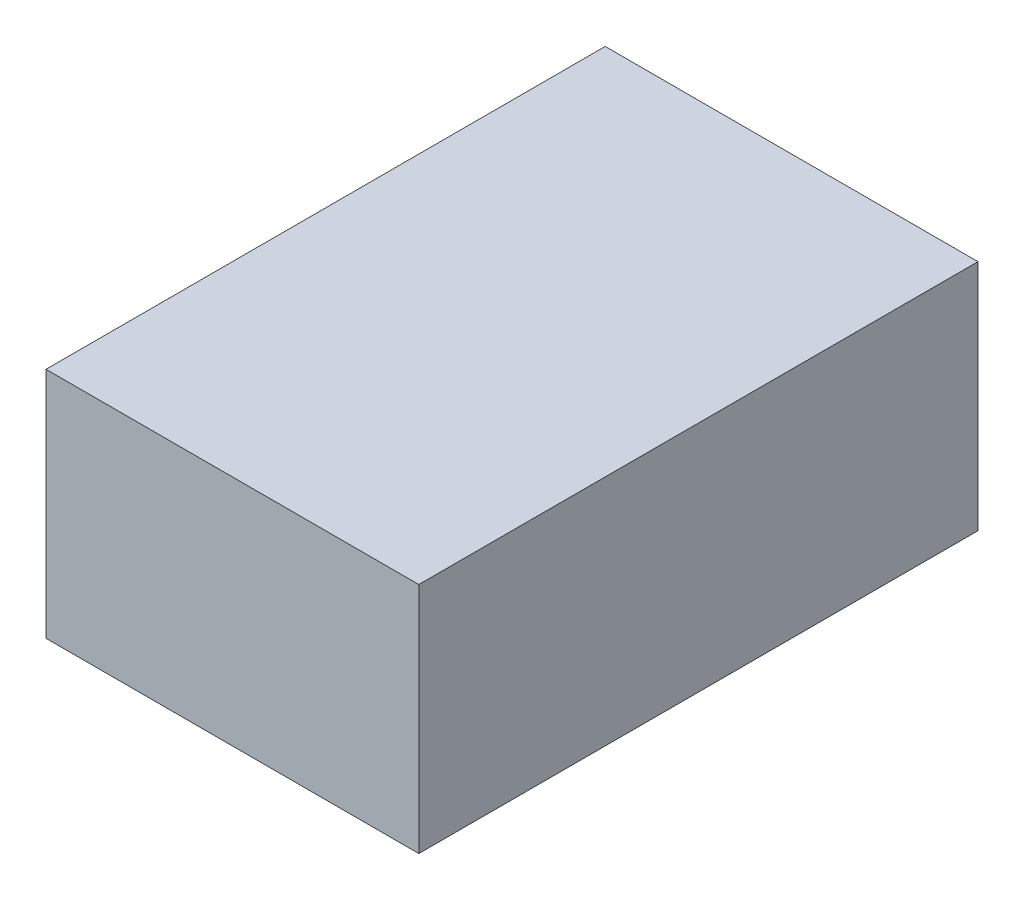
from build123d import *

# Parameters (mm, degrees)
SKETCH1_W           = 203.2
SKETCH1_H           = 127
BOSS_EXTRUDE1_DEPTH = 304.8


with BuildPart() as part:
    # Sketch1 → Boss-Extrude1 (new body)
    with BuildSketch(Plane.XY):
        Rectangle(SKETCH1_W, SKETCH1_H)
    extrude(amount=BOSS_EXTRUDE1_DEPTH)


solid = part.part
